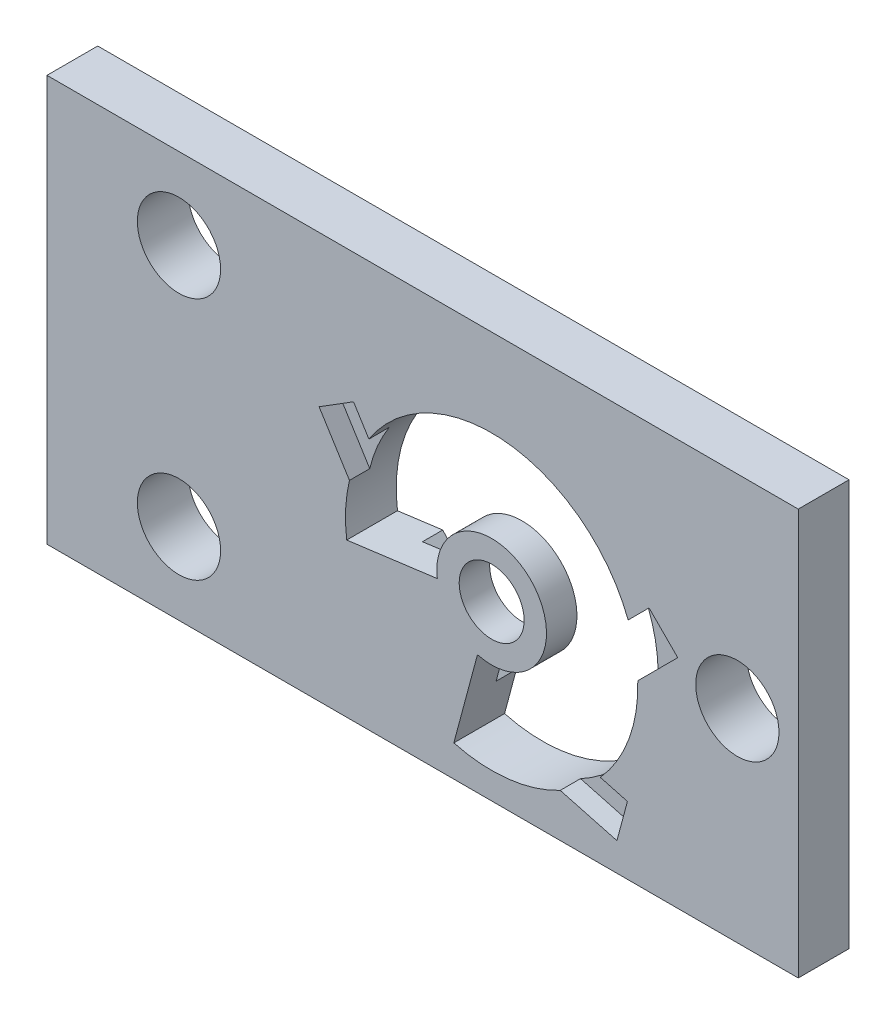
from build123d import *

# Parameters (mm, degrees)
ESQUISSE1_W             = 37
ESQUISSE1_H             = 20
ESQUISSE1_R             = 2.05
ESQUISSE1_R_2           = 1.6
BOSS_EXTRU_1_DEPTH      = 2.5
ESQUISSE3_R             = 1.6
ENL_V_MAT_EXTRU_1_DEPTH = 1
ENL_V_MAT_EXTRU_2_DEPTH = 1


with BuildPart() as part:
    # Esquisse1 → Boss.-Extru.1 (new body)
    with BuildSketch(Plane.XY):
        Rectangle(ESQUISSE1_W, ESQUISSE1_H)
        with Locations((-12, 6)):
            Circle(ESQUISSE1_R, mode=Mode.SUBTRACT)
        with Locations((-12, -6)):
            Circle(ESQUISSE1_R, mode=Mode.SUBTRACT)
        with Locations((15.5, 0)):
            Circle(ESQUISSE1_R, mode=Mode.SUBTRACT)
        with Locations((3.4, -1.5)):
            Circle(ESQUISSE1_R_2, mode=Mode.SUBTRACT)
        with BuildLine():
            Line((-3.738369819, -2.440040602), (0.723111318, -1.852515226))
            ThreePointArc((0.723111318, -1.852515226), (5.429936055, 0.280269534), (2.701188578, -4.107999731))
            Line((2.701188578, -4.107999731), (1.536502875, -8.454665949))
            ThreePointArc((1.536502875, -8.454665949), (8.813162812, 3.247385424), (-3.738369819, -2.440040602))
        make_face(mode=Mode.SUBTRACT)
    extrude(amount=BOSS_EXTRU_1_DEPTH)

    # Esquisse3 → Enlèv. mat.-Extru.1 (cut)
    # profile 1 of 2: a face of its own
    with BuildSketch(Plane(origin=(0, 0, 0), x_dir=(-1, 0, 0), z_dir=(0, 0, -1))):
        with BuildLine():
            Line((3.738369819, -2.440040602), (-0.723111318, -1.852515226))
            ThreePointArc((-0.723111318, -1.852515226), (-5.429936055, 0.280269534), (-2.701188578, -4.107999731))
            Line((-2.701188578, -4.107999731), (-1.536502875, -8.454665949))
            ThreePointArc((-1.536502875, -8.454665949), (-8.813162812, 3.247385424), (3.738369819, -2.440040602))
        make_face()
    # profile 2 of 2: a face of its own
    with BuildSketch(Plane(origin=(0, 0, 0), x_dir=(-1, 0, 0), z_dir=(0, 0, -1))):
        with BuildLine():
            Line((-2.118845727, -6.28133284), (1.50762925, -2.146277914))
            Line((1.50762925, -2.146277914), (-0.723111318, -1.852515226))
            ThreePointArc((-0.723111318, -1.852515226), (-5.429936055, 0.280269534), (-2.701188578, -4.107999731))
            Line((-2.701188578, -4.107999731), (-2.118845727, -6.28133284))
        make_face()
        with Locations((-3.4, -1.5)):
            Circle(ESQUISSE3_R, mode=Mode.SUBTRACT)
    extrude(amount=-ENL_V_MAT_EXTRU_1_DEPTH, mode=Mode.SUBTRACT)

    # Esquisse4 → Enlèv. mat.-Extru.2 (cut)
    with BuildSketch(Plane.XY.offset(2.5)):
        Polygon((-5.098492824, 2.565126725), (-3.402396632, 3.624965253), (-1.282719575, 0.232772869), (-2.978815767, -0.82706566), align=None)
        Polygon((11.151538443, 2.109938013), (12.565752005, 0.69572445), (9.73732488, -2.132702674), (8.323111318, -0.718489112), align=None)
        Polygon((10.086814623, -6.675295623), (9.569176533, -8.607147276), (5.705473228, -7.571871096), (6.223111318, -5.640019443), align=None)
    extrude(amount=-ENL_V_MAT_EXTRU_2_DEPTH, mode=Mode.SUBTRACT)


solid = part.part
